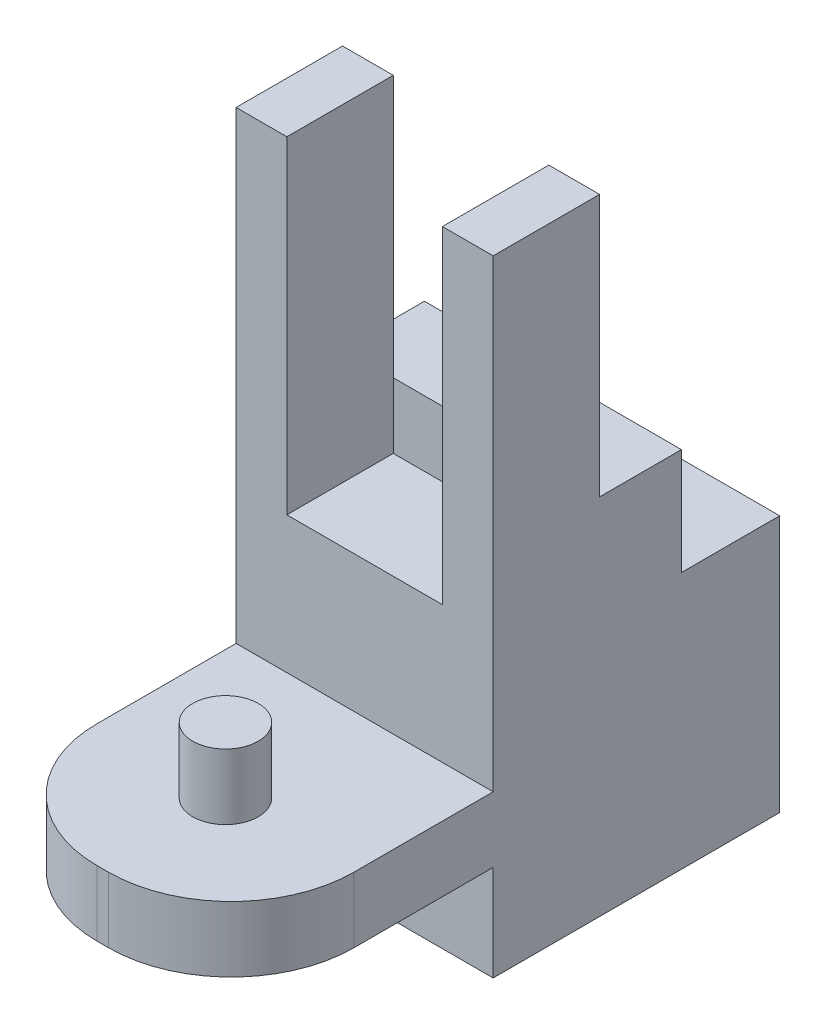
from build123d import *

# Parameters (mm, degrees)
SKETCH4_W            = 31.4
SKETCH4_H            = 31.4
SKETCH4_W_2          = 25.4
SKETCH4_H_2          = 25.4
BOSS_EXTRUDE3_DEPTH  = 30
SKETCH5_W            = 31.4
SKETCH5_H            = 31.4
BOSS_EXTRUDE4_DEPTH  = 5
SKETCH6_W            = 31.4
SKETCH6_H            = 8
BOSS_EXTRUDE5_DEPTH  = 5
BOSS_EXTRUDE6_DEPTH  = 8
SKETCH8_R            = 4
BOSS_EXTRUDE7_DEPTH  = 8
SKETCH9_W            = 31.4
SKETCH9_H            = 10
BOSS_EXTRUDE8_DEPTH  = 5
SKETCH10_W           = 31.4
SKETCH10_H           = 10
BOSS_EXTRUDE9_DEPTH  = 13
SKETCH11_W           = 6.2
SKETCH11_H           = 10
BOSS_EXTRUDE10_DEPTH = 40
BOSS_EXTRUDE11_DEPTH = 3


with BuildPart() as part:
    # Sketch4 → Boss-Extrude3 (new body)
    with BuildSketch(Plane.XY):
        Rectangle(SKETCH4_W, SKETCH4_H)
        Rectangle(SKETCH4_W_2, SKETCH4_H_2, mode=Mode.SUBTRACT)
    extrude(amount=BOSS_EXTRUDE3_DEPTH)

    # Sketch5 → Boss-Extrude4 (add)
    with BuildSketch(Plane.XY.offset(30)):
        Rectangle(SKETCH5_W, SKETCH5_H)
    extrude(amount=BOSS_EXTRUDE4_DEPTH)

    # Sketch6 → Boss-Extrude5 (add)
    with BuildSketch(Plane.XY.offset(35)):
        Rectangle(SKETCH6_W, SKETCH6_H)
    extrude(amount=BOSS_EXTRUDE5_DEPTH)

    # Sketch7 → Boss-Extrude6 (add)
    with BuildSketch(Plane.XZ.offset(4)):
        with BuildLine():
            Line((-15.7, 40), (-15.7, 52))
            ThreePointArc((-15.7, 52), (-11.306601718, 62.606601718), (-0.7, 67))
            Line((-0.7, 67), (0.7, 67))
            ThreePointArc((0.7, 67), (11.306601718, 62.606601718), (15.7, 52))
            Line((15.7, 52), (15.7, 40))
            Line((15.7, 40), (-15.7, 40))
        make_face()
    extrude(amount=-BOSS_EXTRUDE6_DEPTH)

    # Sketch8 → Boss-Extrude7 (add)
    with BuildSketch(Plane.XZ.offset(4)):
        with Locations(Location((0, 52, 0), (0, 0, 180))):
            Circle(SKETCH8_R)
    boss_extrude7 = extrude(amount=BOSS_EXTRUDE7_DEPTH)

    # Mirror1: Boss-Extrude7 across plane
    add(boss_extrude7.mirror(Plane.ZX))

    # Sketch9 → Boss-Extrude8 (add)
    with BuildSketch(Plane(origin=(0, 15.7, 0), x_dir=(1, 0, 0), z_dir=(0, 1, 0))):
        with Locations((0, -27)):
            Rectangle(SKETCH9_W, SKETCH9_H)
    extrude(amount=BOSS_EXTRUDE8_DEPTH)

    # Sketch10 → Boss-Extrude9 (add)
    with BuildSketch(Plane(origin=(0, 15.7, 0), x_dir=(1, 0, 0), z_dir=(0, 1, 0))):
        with Locations((0, -17)):
            Rectangle(SKETCH10_W, SKETCH10_H)
    extrude(amount=BOSS_EXTRUDE9_DEPTH)

    # Sketch11 → Boss-Extrude10 (add)
    with BuildSketch(Plane(origin=(0, 20.7, 0), x_dir=(1, 0, 0), z_dir=(0, 1, 0))):
        with Locations((-12.6, -27)):
            Rectangle(SKETCH11_W, SKETCH11_H)
        with Locations((12.6, -27)):
            Rectangle(SKETCH11_W, SKETCH11_H)
    extrude(amount=BOSS_EXTRUDE10_DEPTH)

    # Sketch12 → Boss-Extrude11 (add)
    with BuildSketch(Plane.XY.offset(32)):
        Polygon((-15.7, 60.7), (-9.5, 60.7), (-9.5, 20.7), (9.5, 20.7), (9.5, 60.7), (15.7, 60.7), (15.7, 15.7), (-15.7, 15.7), align=None)
    extrude(amount=BOSS_EXTRUDE11_DEPTH)


solid = part.part
